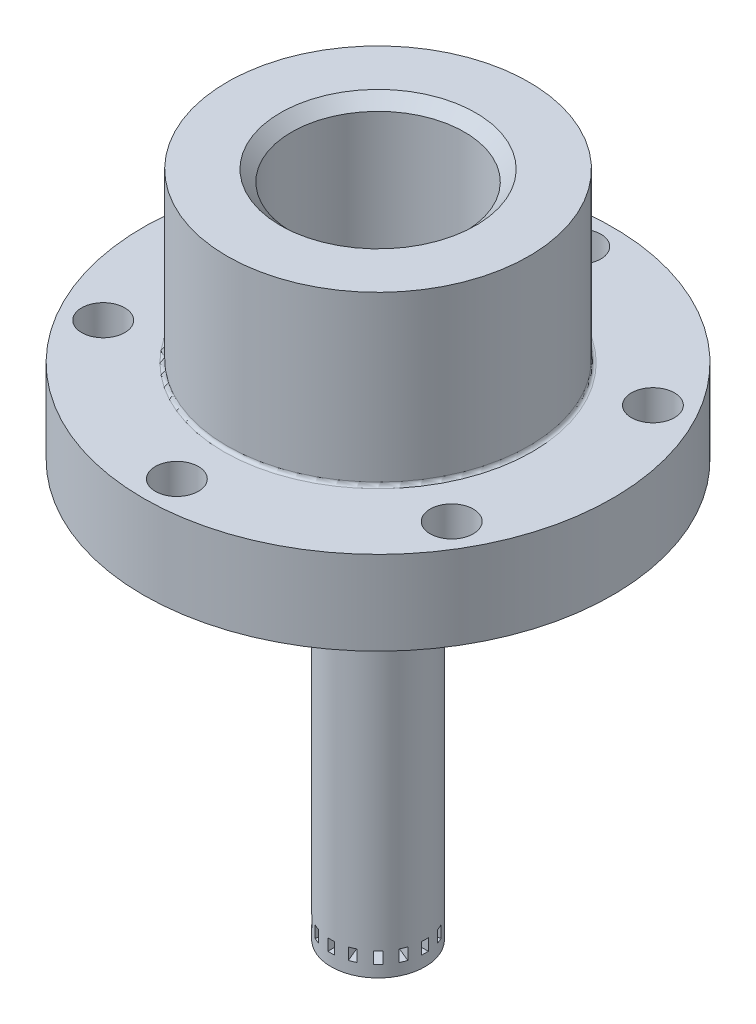
from build123d import *
from build123d.topology import SkipClean

# Parameters (mm, degrees)
SKETCH1_W               = 2.032
SKETCH1_H               = 25.146
CUT_EXTRUDE1_REACH      = 26.41
CUT_EXTRUDE1_END_RADIUS = 1.524
SKETCH2_W               = 0.508
SKETCH2_H               = 0.889
CIRPATTERN1_COUNT       = 16
SKETCH3_R               = 3.556
SKETCH3_R_2             = 1.524
BOSS_EXTRUDE1_DEPTH     = 6.35
BOSS_EXTRUDE2_START     = 6.35
SKETCH4_R               = 17.78
SKETCH4_R_2             = 1.524
BOSS_EXTRUDE2_DEPTH     = 6.35
CUT_EXTRUDE2_REACH      = 47.438
SKETCH11_R              = 1.63195
CIRPATTERN2_COUNT       = 6
CHAMFER1_SIZE           = 3.048
CHAMFER1_SIZE2          = 5.279290861
SKETCH13_R              = 11.43
SKETCH13_R_2            = 6.54812
BOSS_EXTRUDE4_DEPTH     = 12.7
FILLET4_R               = 0.254
CHAMFER2_SIZE           = 0.851662
CHAMFER2_SIZE2          = 0.83947
BOSS_EXTRUDE5_START     = -6.35
SKETCH15_R              = 4.699
SKETCH15_R_2            = 3.556
BOSS_EXTRUDE5_DEPTH     = 6.35


with BuildPart() as part:
    # Sketch1 → Revolve2 (revolve)
    with BuildSketch(Plane.XY):
        with Locations((-2.54, 10.505774136)):
            Rectangle(SKETCH1_W, SKETCH1_H)
    revolve(axis=Axis((0, 8.215698649, 0), (0, -1, 0)))

    # Cut-Extrude1: up to this cylinder (the profile starts outside it)
    cut_extrude1_end = Plane(origin=(0, -0.733726, 0), z_dir=(0, 1, 0)) * Cylinder(CUT_EXTRUDE1_END_RADIUS, 56.868, mode=Mode.PRIVATE)
    # Sketch2 → Cut-Extrude1 (cut, up to the surface)
    with BuildSketch(Plane.ZY.offset(3.556), mode=Mode.PRIVATE) as cut_extrude1_sk1:
        with Locations((0.000240101, -0.733725864)):
            Rectangle(SKETCH2_W, SKETCH2_H)
    cut_extrude1_tool1 = extrude(cut_extrude1_sk1.sketch, amount=-CUT_EXTRUDE1_REACH, mode=Mode.PRIVATE) - cut_extrude1_end
    cut_extrude1 = cut_extrude1_tool1.solids().sort_by_distance((-3.556, -0.733726, 0.00024))[0]
    add(cut_extrude1, mode=Mode.SUBTRACT)

    # CirPattern1: Cut-Extrude1 ×16 about axis
    cirpattern1_axis = Axis((0, -2.067225864, 0), (0, 1, 0))
    for i in range(1, CIRPATTERN1_COUNT):
        add(cut_extrude1.rotate(cirpattern1_axis, i * 360 / CIRPATTERN1_COUNT), mode=Mode.SUBTRACT)

    # Sketch3 → Boss-Extrude1 (add)
    with BuildSketch(Plane(origin=(0, 23.078774136, 0), x_dir=(-1, 0, 0), z_dir=(0, -1, 0))):
        Circle(SKETCH3_R)
        Circle(SKETCH3_R_2, mode=Mode.SUBTRACT)
    extrude(amount=-BOSS_EXTRUDE1_DEPTH)

    # Sketch4 → Boss-Extrude2 (add)
    with SkipClean():  # the faces are left unmerged after this step: merging them gives an invalid solid
        with BuildSketch(Plane(origin=(0, 29.428774136, 0), x_dir=(1, 0, 0), z_dir=(0, 1, 0)).offset(BOSS_EXTRUDE2_START)):
            Circle(SKETCH4_R)
            Circle(SKETCH4_R_2, mode=Mode.SUBTRACT)
        extrude(amount=-BOSS_EXTRUDE2_DEPTH)

    # Sketch11 → Cut-Extrude2 (cut, up to next)
    with BuildSketch(Plane(origin=(0, 35.778774136, 0), x_dir=(1, 0, 0), z_dir=(0, 1, 0)), mode=Mode.PRIVATE) as cut_extrude2_sk1:
        with Locations((0, -15.24)):
            Circle(SKETCH11_R)
    cut_extrude2_tool1 = extrude(cut_extrude2_sk1.sketch, amount=-CUT_EXTRUDE2_REACH, mode=Mode.PRIVATE) & part.part
    cut_extrude2 = cut_extrude2_tool1.solids().sort_by_distance((0, 35.778774, 15.24))[0]
    add(cut_extrude2, mode=Mode.SUBTRACT)

    # CirPattern2: Cut-Extrude2 ×6 about axis
    with SkipClean():  # the faces are left unmerged after this step: merging them gives an invalid solid
        cirpattern2_axis = Axis((0, -2.067225864, 0), (0, 1, 0))
        for i in range(1, CIRPATTERN2_COUNT):
            add(cut_extrude2.rotate(cirpattern2_axis, i * 360 / CIRPATTERN2_COUNT), mode=Mode.SUBTRACT)

    # Chamfer1
    chamfer1_edges = [part.edges().sort_by_distance(p)[0] for p in [
        (-1.524, 35.778774136, 0),
    ]]
    chamfer1_side = [part.faces().sort_by_distance(p)[0] for p in [
        (-17.277105657, 35.778774136, 0),
    ]]
    chamfer(chamfer1_edges, length=CHAMFER1_SIZE, length2=CHAMFER1_SIZE2, reference=chamfer1_side[0])

    # Sketch13 → Boss-Extrude4 (add)
    with SkipClean():  # the faces are left unmerged after this step: merging them gives an invalid solid
        with BuildSketch(Plane(origin=(0, 35.778774136, 0), x_dir=(1, 0, 0), z_dir=(0, 1, 0))):
            Circle(SKETCH13_R)
            Circle(SKETCH13_R_2, mode=Mode.SUBTRACT)
        extrude(amount=BOSS_EXTRUDE4_DEPTH)

    # Fillet4
    fillet4_edges = [part.edges().sort_by_distance(p)[0] for p in [
        (-11.43, 35.778774136, 0),
    ]]
    fillet(fillet4_edges, radius=FILLET4_R)

    # Chamfer2
    chamfer2_edges = [part.edges().sort_by_distance(p)[0] for p in [
        (-6.54812, 48.478774136, 0),
    ]]
    chamfer2_side = [part.faces().sort_by_distance(p)[0] for p in [
        (-11.10671078, 48.478774136, 0),
    ]]
    chamfer(chamfer2_edges, length=CHAMFER2_SIZE, length2=CHAMFER2_SIZE2, reference=chamfer2_side[0])

    # Sketch15 → Boss-Extrude5 (add)
    with SkipClean():  # the faces are left unmerged after this step: merging them gives an invalid solid
        with BuildSketch(Plane(origin=(0, 29.428774136, 0), x_dir=(1, 0, 0), z_dir=(0, 1, 0)).offset(BOSS_EXTRUDE5_START)):
            Circle(SKETCH15_R)
            Circle(SKETCH15_R_2, mode=Mode.SUBTRACT)
        extrude(amount=BOSS_EXTRUDE5_DEPTH)


solid = part.part
